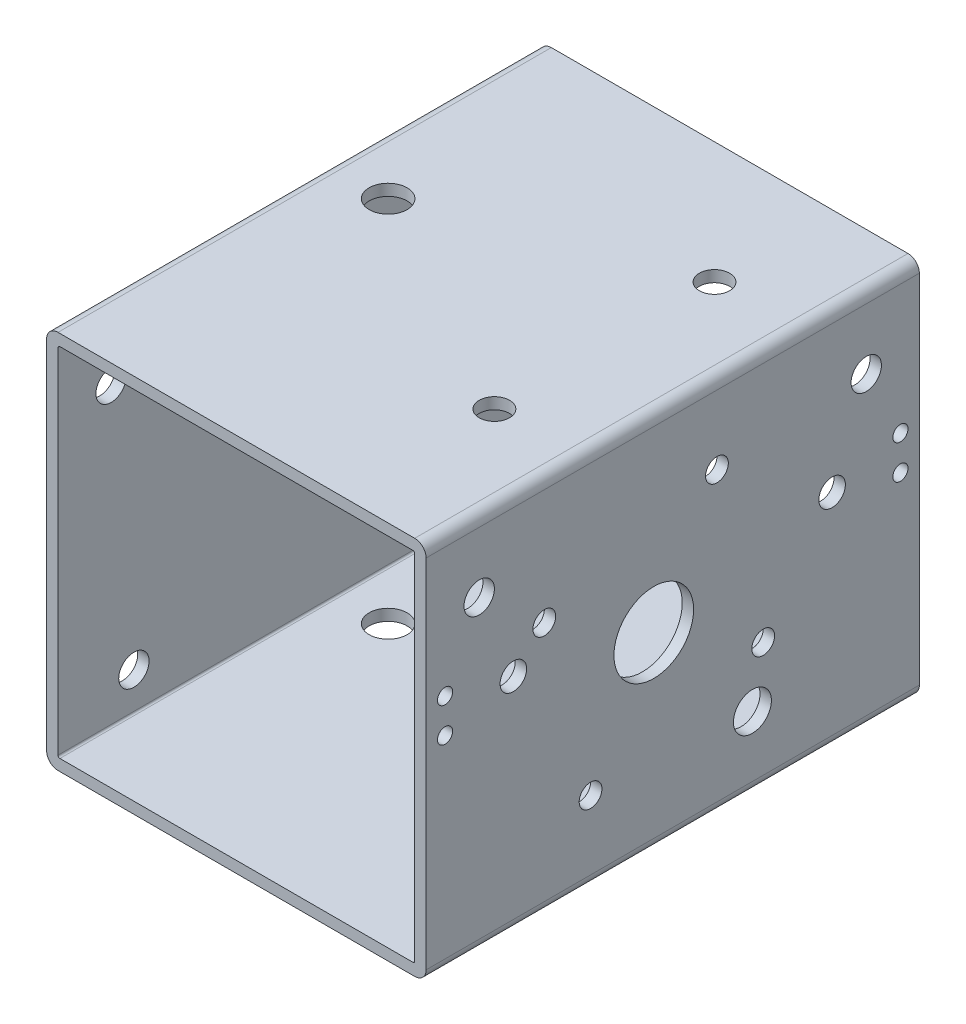
from build123d import *

# Parameters (mm, degrees)
SKETCH1_W                      = 100
SKETCH1_H                      = 100
SKETCH1_W_2                    = 94
SKETCH1_H_2                    = 94
EXTRUDE_THIN1_DEPTH            = 130
FILLET1_R                      = 0.5
FILLET2_R                      = 3
F_8_0_8_DIAMETER_HOLE2_D       = 8
F_8_0_8_DIAMETER_HOLE3_D       = 8
F_10_0_10_DIAMETER_HOLE1_D     = 10
F_10_0_10_DIAMETER_HOLE2_D     = 10
F_6_0_6_DIAMETER_HOLE2_D       = 6
F_6_0_6_DIAMETER_HOLE2_DEPTH   = 3
F_6_0_6_DIAMETER_HOLE3_D       = 6
F_6_0_6_DIAMETER_HOLE3_DEPTH   = 3
F_21_0_21_DIAMETER_HOLE1_D     = 21
F_21_0_21_DIAMETER_HOLE1_DEPTH = 3
F_6_0_6_DIAMETER_HOLE1_D       = 6
F_6_0_6_DIAMETER_HOLE1_DEPTH   = 3
CUT_EXTRUDE1_REACH             = 173.464
SKETCH27_R                     = 2
SKETCH27_R_2                   = 3.5
CUT_EXTRUDE2_REACH             = 173.464
SKETCH31_R                     = 4


with BuildPart() as part:
    # Sketch1 → Extrude-Thin1 (new body)
    with BuildSketch(Plane.XY):
        Rectangle(SKETCH1_W, SKETCH1_H)
        Rectangle(SKETCH1_W_2, SKETCH1_H_2, mode=Mode.SUBTRACT)
    extrude(amount=EXTRUDE_THIN1_DEPTH)

    # Fillet1
    fillet1_edges = [part.edges().sort_by_distance(p)[0] for p in [
        (47, -47, 65),
        (47, 47, 65),
        (-47, 47, 65),
        (-47, -47, 65),
    ]]
    fillet(fillet1_edges, radius=FILLET1_R)

    # Fillet2
    fillet2_edges = [part.edges().sort_by_distance(p)[0] for p in [
        (50, -50, 65),
        (-50, -50, 65),
        (-50, 50, 65),
        (50, 50, 65),
    ]]
    fillet(fillet2_edges, radius=FILLET2_R)

    # Ø8.0 (8) Diameter Hole2 (through all)
    with Locations(Plane(origin=(0, 50, 0), x_dir=(1, 0, 0), z_dir=(0, 1, 0))):
        with Locations((28, -32), (28, -90)):
            Hole(F_8_0_8_DIAMETER_HOLE2_D / 2)

    # Ø8.0 (8) Diameter Hole3 (through all)
    with Locations(Plane(origin=(50, 0, 0), x_dir=(0, 0, -1), z_dir=(1, 0, 0))):
        with Locations((-14, 31), (-116, 31)):
            Hole(F_8_0_8_DIAMETER_HOLE3_D / 2)

    # Ø10.0 (10) Diameter Hole1 (through all)
    with Locations(Plane(origin=(0, 50, 0), x_dir=(1, 0, 0), z_dir=(0, 1, 0))):
        with Locations((-34, -56)):
            Hole(F_10_0_10_DIAMETER_HOLE1_D / 2)

    # Ø10.0 (10) Diameter Hole2 (through all)
    with Locations(Plane(origin=(50, 0, 0), x_dir=(0, 0, -1), z_dir=(1, 0, 0))):
        with Locations((-44, -31)):
            Hole(F_10_0_10_DIAMETER_HOLE2_D / 2)

    # Ø6.0 (6) Diameter Hole2
    with Locations(Plane.ZY.offset(50)):
        with Locations((56, -15), (56, 35)):
            Hole(F_6_0_6_DIAMETER_HOLE2_D / 2, depth=F_6_0_6_DIAMETER_HOLE2_DEPTH)

    # Ø6.0 (6) Diameter Hole3
    with Locations(Plane(origin=(0, -50, 0), x_dir=(-1, 0, 0), z_dir=(0, -1, 0))):
        with Locations((20, -44), (-35, -44)):
            Hole(F_6_0_6_DIAMETER_HOLE3_D / 2, depth=F_6_0_6_DIAMETER_HOLE3_DEPTH)

    # Ø21.0 (21) Diameter Hole1
    with Locations(Plane(origin=(50, 0, 0), x_dir=(0, 0, -1), z_dir=(1, 0, 0))):
        with Locations((-70, 0)):
            Hole(F_21_0_21_DIAMETER_HOLE1_D / 2, depth=F_21_0_21_DIAMETER_HOLE1_DEPTH)

    # Ø6.0 (6) Diameter Hole1
    with Locations(Plane(origin=(50, 0, 0), x_dir=(0, 0, -1), z_dir=(1, 0, 0))):
        with Locations((-41.157258279, -16.652364697), (-53.347635303, 28.842741721), (-98.842741721, 16.652364697), (-86.652364697, -28.842741721)):
            Hole(F_6_0_6_DIAMETER_HOLE1_D / 2, depth=F_6_0_6_DIAMETER_HOLE1_DEPTH)

    # Sketch27 → Cut-Extrude1 (cut, up to next)
    with BuildSketch(Plane(origin=(50, 0, 0), x_dir=(0, 0, -1), z_dir=(1, 0, 0)), mode=Mode.PRIVATE) as cut_extrude1_sk1:
        with Locations(Location((-5, 13, 0), (0, 0, 90))):
            Circle(SKETCH27_R)
    cut_extrude1_tool1 = extrude(cut_extrude1_sk1.sketch, amount=-CUT_EXTRUDE1_REACH, mode=Mode.PRIVATE) & part.part
    # Sketch27 → Cut-Extrude1 (cut, up to next)
    with BuildSketch(Plane(origin=(50, 0, 0), x_dir=(0, 0, -1), z_dir=(1, 0, 0)), mode=Mode.PRIVATE) as cut_extrude1_sk2:
        with Locations(Location((-5, 4, 0), (0, 0, 90))):
            Circle(SKETCH27_R)
    cut_extrude1_tool2 = extrude(cut_extrude1_sk2.sketch, amount=-CUT_EXTRUDE1_REACH, mode=Mode.PRIVATE) & part.part
    # Sketch27 → Cut-Extrude1 (cut, up to next)
    with BuildSketch(Plane(origin=(50, 0, 0), x_dir=(0, 0, -1), z_dir=(1, 0, 0)), mode=Mode.PRIVATE) as cut_extrude1_sk3:
        with Locations(Location((-23, 8.5, 0), (0, 0, 90))):
            Circle(SKETCH27_R_2)
    cut_extrude1_tool3 = extrude(cut_extrude1_sk3.sketch, amount=-CUT_EXTRUDE1_REACH, mode=Mode.PRIVATE) & part.part
    # Sketch27 → Cut-Extrude1 (cut, up to next)
    with BuildSketch(Plane(origin=(50, 0, 0), x_dir=(0, 0, -1), z_dir=(1, 0, 0)), mode=Mode.PRIVATE) as cut_extrude1_sk4:
        with Locations(Location((-107, 8.5, 0), (0, 0, 270))):
            Circle(SKETCH27_R_2)
    cut_extrude1_tool4 = extrude(cut_extrude1_sk4.sketch, amount=-CUT_EXTRUDE1_REACH, mode=Mode.PRIVATE) & part.part
    # Sketch27 → Cut-Extrude1 (cut, up to next)
    with BuildSketch(Plane(origin=(50, 0, 0), x_dir=(0, 0, -1), z_dir=(1, 0, 0)), mode=Mode.PRIVATE) as cut_extrude1_sk5:
        with Locations(Location((-125, 4, 0), (0, 0, 270))):
            Circle(SKETCH27_R)
    cut_extrude1_tool5 = extrude(cut_extrude1_sk5.sketch, amount=-CUT_EXTRUDE1_REACH, mode=Mode.PRIVATE) & part.part
    # Sketch27 → Cut-Extrude1 (cut, up to next)
    with BuildSketch(Plane(origin=(50, 0, 0), x_dir=(0, 0, -1), z_dir=(1, 0, 0)), mode=Mode.PRIVATE) as cut_extrude1_sk6:
        with Locations(Location((-125, 13, 0), (0, 0, 270))):
            Circle(SKETCH27_R)
    cut_extrude1_tool6 = extrude(cut_extrude1_sk6.sketch, amount=-CUT_EXTRUDE1_REACH, mode=Mode.PRIVATE) & part.part
    add(cut_extrude1_tool1.solids().sort_by_distance((50, 13, 5))[0], mode=Mode.SUBTRACT)
    add(cut_extrude1_tool2.solids().sort_by_distance((50, 4, 5))[0], mode=Mode.SUBTRACT)
    add(cut_extrude1_tool3.solids().sort_by_distance((50, 8.5, 23))[0], mode=Mode.SUBTRACT)
    add(cut_extrude1_tool4.solids().sort_by_distance((50, 8.5, 107))[0], mode=Mode.SUBTRACT)
    add(cut_extrude1_tool5.solids().sort_by_distance((50, 4, 125))[0], mode=Mode.SUBTRACT)
    add(cut_extrude1_tool6.solids().sort_by_distance((50, 13, 125))[0], mode=Mode.SUBTRACT)

    # Sketch31 → Cut-Extrude2 (cut, up to next)
    with BuildSketch(Plane.ZY.offset(50), mode=Mode.PRIVATE) as cut_extrude2_sk1:
        with Locations(Location((14, -37, 0), (0, 0, 270))):
            Circle(SKETCH31_R)
    cut_extrude2_tool1 = extrude(cut_extrude2_sk1.sketch, amount=-CUT_EXTRUDE2_REACH, mode=Mode.PRIVATE) & part.part
    # Sketch31 → Cut-Extrude2 (cut, up to next)
    with BuildSketch(Plane.ZY.offset(50), mode=Mode.PRIVATE) as cut_extrude2_sk2:
        with Locations(Location((110, -37, 0), (0, 0, 270))):
            Circle(SKETCH31_R)
    cut_extrude2_tool2 = extrude(cut_extrude2_sk2.sketch, amount=-CUT_EXTRUDE2_REACH, mode=Mode.PRIVATE) & part.part
    add(cut_extrude2_tool1.solids().sort_by_distance((-50, -37, 14))[0], mode=Mode.SUBTRACT)
    add(cut_extrude2_tool2.solids().sort_by_distance((-50, -37, 110))[0], mode=Mode.SUBTRACT)


solid = part.part
